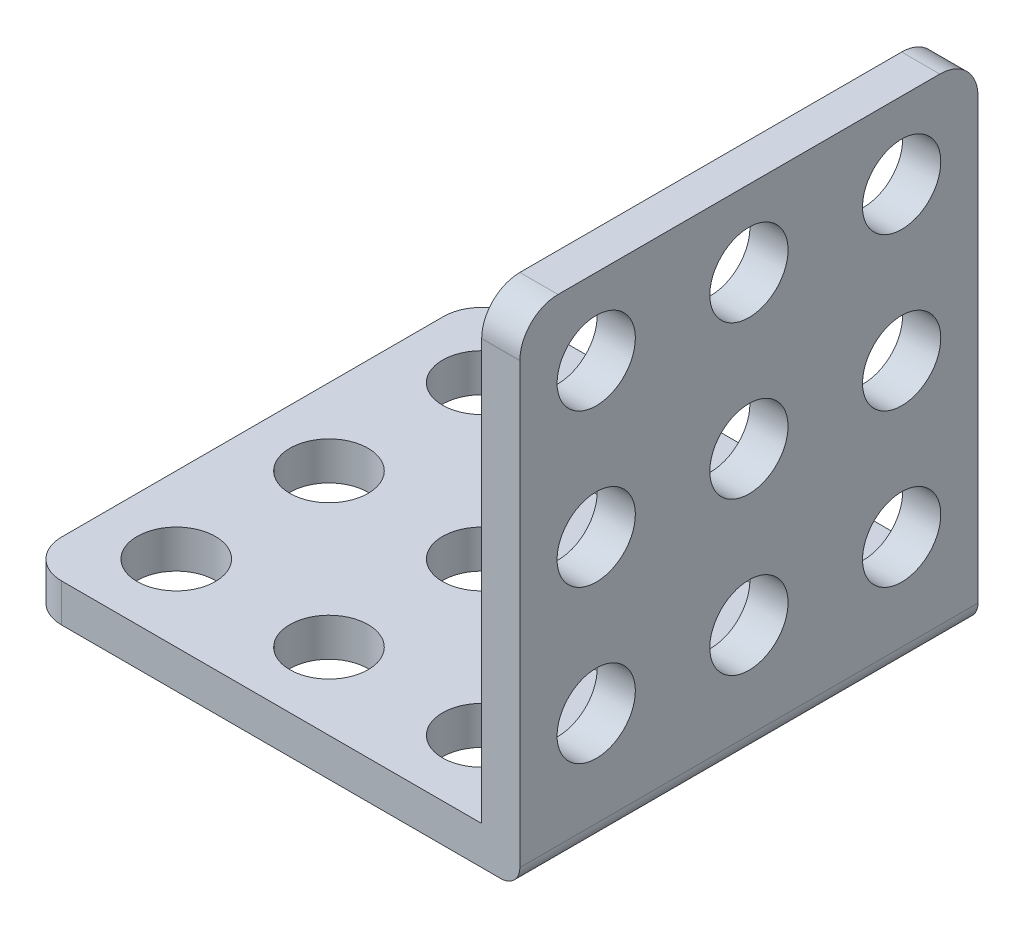
from build123d import *

# Parameters (mm, degrees)
BOSS_EXTRUDE1_DEPTH = 24
SKETCH2_R           = 2.05
CUT_EXTRUDE1_DEPTH  = 42.569219382
SKETCH4_R           = 2.05
CUT_EXTRUDE2_DEPTH  = 42.569219382
FILLET_1_R          = 1
FILLET_2_R          = 2


with BuildPart() as part:
    # Sketch1 → Boss-Extrude1 (new body)
    with BuildSketch(Plane.XY):
        Polygon((-24, 0), (0, 0), (0, 24), (2, 24), (2, -2), (-24, -2), align=None)
    extrude(amount=BOSS_EXTRUDE1_DEPTH)

    # Sketch2 → Cut-Extrude1 (cut, through all)
    with BuildSketch(Plane(origin=(0, 0, 0), x_dir=(1, 0, 0), z_dir=(0, 1, 0))):
        with Locations(Location((-20, -12, 0), (0, 0, 270))):
            Circle(SKETCH2_R)
        with Locations(Location((-12, -12, 0), (0, 0, 270))):
            Circle(SKETCH2_R)
        with Locations(Location((-20, -4, 0), (0, 0, 270))):
            Circle(SKETCH2_R)
        with Locations(Location((-4, -4, 0), (0, 0, 270))):
            Circle(SKETCH2_R)
        with Locations(Location((-12, -4, 0), (0, 0, 270))):
            Circle(SKETCH2_R)
        with Locations(Location((-4, -12, 0), (0, 0, 270))):
            Circle(SKETCH2_R)
        with Locations(Location((-20, -20, 0), (0, 0, 270))):
            Circle(SKETCH2_R)
        with Locations(Location((-12, -20, 0), (0, 0, 270))):
            Circle(SKETCH2_R)
        with Locations(Location((-4, -20, 0), (0, 0, 270))):
            Circle(SKETCH2_R)
    extrude(amount=-CUT_EXTRUDE1_DEPTH, mode=Mode.SUBTRACT)

    # Sketch4 → Cut-Extrude2 (cut, through all)
    with BuildSketch(Plane.ZY):
        with Locations(Location((12, 20, 0), (0, 0, 270))):
            Circle(SKETCH4_R)
        with Locations(Location((12, 12, 0), (0, 0, 270))):
            Circle(SKETCH4_R)
        with Locations(Location((20, 4, 0), (0, 0, 270))):
            Circle(SKETCH4_R)
        with Locations(Location((20, 20, 0), (0, 0, 270))):
            Circle(SKETCH4_R)
        with Locations(Location((20, 12, 0), (0, 0, 270))):
            Circle(SKETCH4_R)
        with Locations(Location((12, 4, 0), (0, 0, 270))):
            Circle(SKETCH4_R)
        with Locations(Location((4, 20, 0), (0, 0, 270))):
            Circle(SKETCH4_R)
        with Locations(Location((4, 12, 0), (0, 0, 270))):
            Circle(SKETCH4_R)
        with Locations(Location((4, 4, 0), (0, 0, 270))):
            Circle(SKETCH4_R)
    extrude(amount=-CUT_EXTRUDE2_DEPTH, mode=Mode.SUBTRACT)

    # 圆角1
    fillet_1_edges = [part.edges().sort_by_distance(p)[0] for p in [
        (2, -2, 12),
    ]]
    fillet(fillet_1_edges, radius=FILLET_1_R)

    # 圆角2
    fillet_2_edges = [part.edges().sort_by_distance(p)[0] for p in [
        (1, 24, 24),
        (-24, -1, 24),
        (1, 24, 0),
        (-24, -1, 0),
    ]]
    fillet(fillet_2_edges, radius=FILLET_2_R)


solid = part.part
